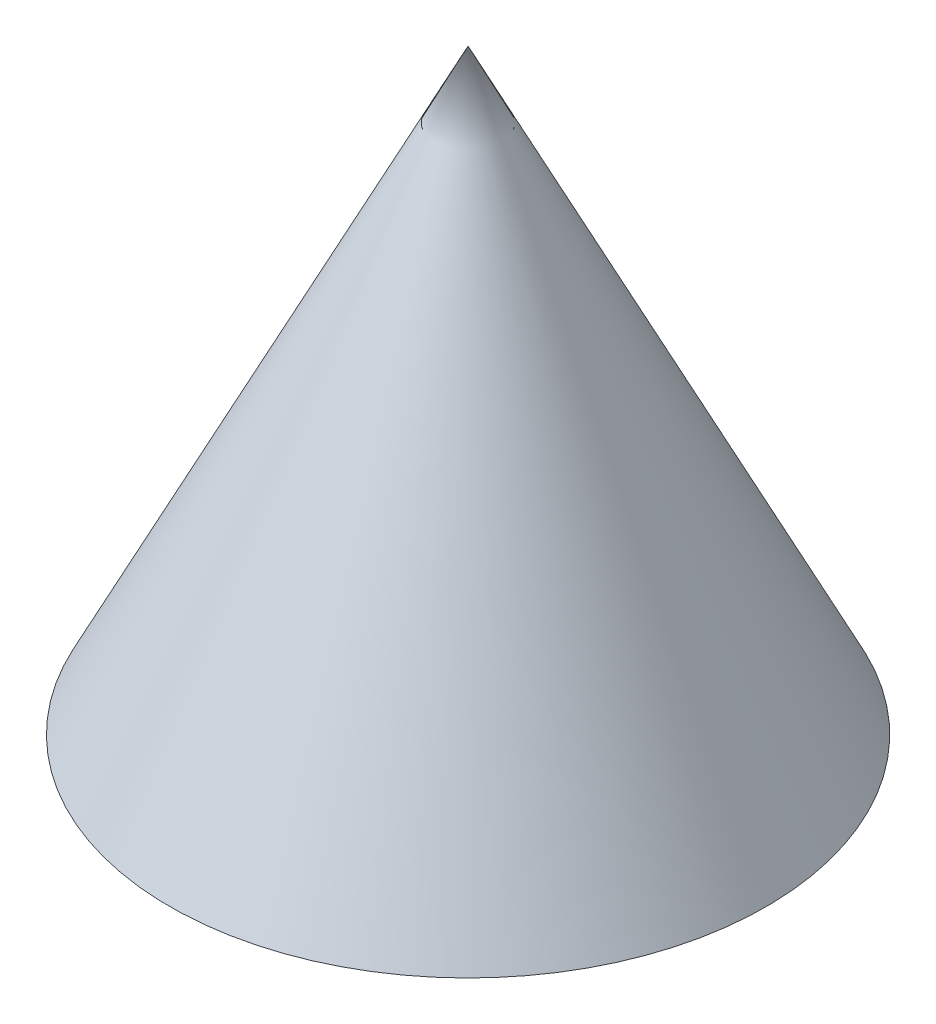
from build123d import *


with BuildPart() as part:
    # Sketch1 → Revolve1 (revolve)
    with BuildSketch(Plane.XY, mode=Mode.PRIVATE) as revolve1_sk:
        Polygon((0, 0), (0, 50), (25, 0), align=None)
    revolve(revolve1_sk.sketch.rotate(Axis((0, 0, 0), (0, 1, 0)), 90), axis=Axis((0, 0, 0), (0, 1, 0)))


solid = part.part
